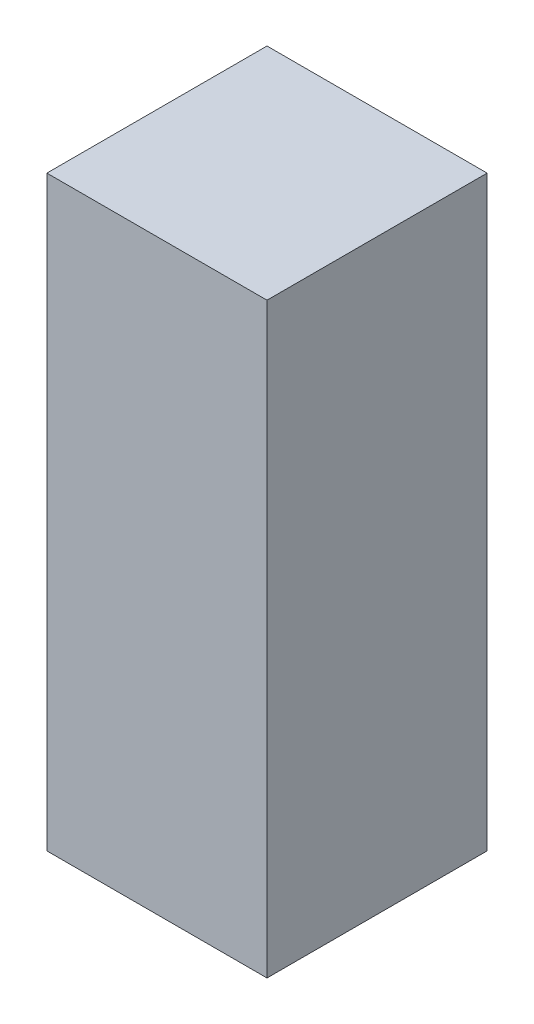
from build123d import *

# Parameters (mm, degrees)
SKETCH2_W           = 76.2
SKETCH2_H           = 76.2
SKETCH2_W_2         = 73.66
SKETCH2_H_2         = 73.66
BOSS_EXTRUDE1_DEPTH = 203.2
SKETCH3_W           = 73.66
SKETCH3_H           = 73.66
BOSS_EXTRUDE2_DEPTH = 1.27


with BuildPart() as part:
    # Sketch2 → Boss-Extrude1 (new body)
    with BuildSketch(Plane(origin=(0, 0, 0), x_dir=(1, 0, 0), z_dir=(0, 1, 0))):
        Rectangle(SKETCH2_W, SKETCH2_H)
        Rectangle(SKETCH2_W_2, SKETCH2_H_2, mode=Mode.SUBTRACT)
    extrude(amount=BOSS_EXTRUDE1_DEPTH)

    # Sketch3 → Boss-Extrude2 (add)
    with BuildSketch(Plane(origin=(0, 203.2, 0), x_dir=(1, 0, 0), z_dir=(0, 1, 0))):
        Rectangle(SKETCH3_W, SKETCH3_H)
    extrude(amount=-BOSS_EXTRUDE2_DEPTH)


solid = part.part
